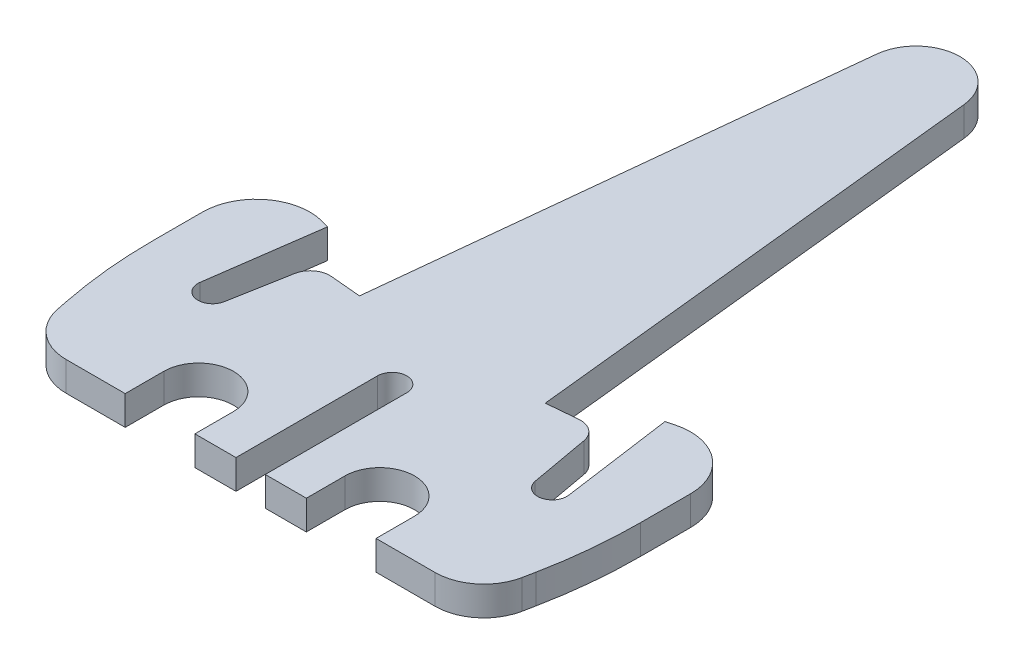
from build123d import *

# Parameters (mm, degrees)
BOSS_EXTRUDE1_DEPTH = 3


with BuildPart() as part:
    # Sketch1 → Boss-Extrude1 (new body)
    with BuildSketch(Plane(origin=(0, 0, 0), x_dir=(1, 0, 0), z_dir=(0, 1, 0))):
        with BuildLine():
            Line((9.517238433, 6.170000059), (4.475348529, 54.140378143))
            ThreePointArc((4.475348529, 54.140378143), (0, 58.170000059), (-4.475348529, 54.140378143))
            Line((-4.475348529, 54.140378143), (-9.517238433, 6.170000059))
            Line((-9.517238433, 6.170000059), (-12.681421496, 6.456296542))
            ThreePointArc((-12.681421496, 6.456296542), (-14.073969481, 6.055116146), (-14.830006559, 4.818773339))
            Line((-14.830006559, 4.818773339), (-15.924976658, -1.263790774))
            ThreePointArc((-15.924976658, -1.263790774), (-17.63807349, -2.479222243), (-18.88678283, -0.790228639))
            Line((-18.88678283, -0.790228639), (-17.283321202, 10.672322207))
            Line((-17.283321202, 10.672322207), (-18.076495252, 10.884852553))
            ThreePointArc((-18.076495252, 10.884852553), (-22.84818786, 9.93570388), (-25, 5.572260508))
            Line((-25, 5.572260508), (-25, 0.469626677))
            ThreePointArc((-25, 0.469626677), (-24.758369054, -4.440028009), (-24.035811635, -9.302229714))
            Line((-24.035811635, -9.302229714), (-23.801666433, -10.47718558))
            ThreePointArc((-23.801666433, -10.47718558), (-22.069368276, -13.365612971), (-18.89808527, -14.499999941))
            Line((-18.89808527, -14.499999941), (-12.85, -14.499999941))
            Line((-12.85, -14.499999941), (-12.85, -10.549999941))
            ThreePointArc((-12.85, -10.549999941), (-9.28, -6.979999941), (-5.71, -10.549999941))
            Line((-5.71, -10.549999941), (-5.71, -14.499999941))
            Line((-5.71, -14.499999941), (-1.500000059, -14.499999941))
            Line((-1.500000059, -14.499999941), (-1.500000059, 0))
            ThreePointArc((-1.500000059, 0), (0, 1.500000059), (1.500000059, 0))
            Line((1.500000059, 0), (1.500000059, -14.499999941))
            Line((1.500000059, -14.499999941), (5.71, -14.499999941))
            Line((5.71, -14.499999941), (5.71, -10.549999941))
            ThreePointArc((5.71, -10.549999941), (9.28, -6.979999941), (12.85, -10.549999941))
            Line((12.85, -10.549999941), (12.85, -14.499999941))
            Line((12.85, -14.499999941), (18.89808527, -14.499999941))
            ThreePointArc((18.89808527, -14.499999941), (22.069368276, -13.365612971), (23.801666433, -10.47718558))
            Line((23.801666433, -10.47718558), (24.035811635, -9.302229714))
            ThreePointArc((24.035811635, -9.302229714), (24.758369054, -4.440028009), (25, 0.469626677))
            Line((25, 0.469626677), (25, 5.572260508))
            ThreePointArc((25, 5.572260508), (22.84818786, 9.93570388), (18.076495252, 10.884852553))
            Line((18.076495252, 10.884852553), (17.283321202, 10.672322207))
            Line((17.283321202, 10.672322207), (18.88678283, -0.790228639))
            ThreePointArc((18.88678283, -0.790228639), (17.63807349, -2.479222243), (15.924976658, -1.263790774))
            Line((15.924976658, -1.263790774), (14.830006559, 4.818773339))
            ThreePointArc((14.830006559, 4.818773339), (14.073969481, 6.055116146), (12.681421496, 6.456296542))
            Line((12.681421496, 6.456296542), (9.517238433, 6.170000059))
        make_face()
    extrude(amount=BOSS_EXTRUDE1_DEPTH)


solid = part.part
